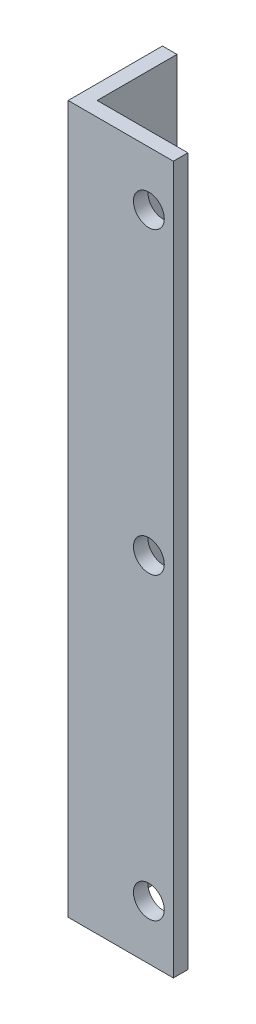
from build123d import *

# Parameters (mm, degrees)
CROQUIS1_W              = 25
CROQUIS1_H              = 3
SALIENTE_EXTRUIR1_DEPTH = 195
CROQUIS2_R              = 4.25
CORTAR_EXTRUIR1_DEPTH   = 195
CROQUIS3_W              = 4
CROQUIS3_H              = 25
SALIENTE_EXTRUIR2_DEPTH = 195
SALIENTE_EXTRUIR3_START = 1
CROQUIS4_W              = 29
CROQUIS4_H              = 195
CROQUIS4_R              = 4.25
SALIENTE_EXTRUIR3_DEPTH = 1


with BuildPart() as part:
    # Croquis1 → Saliente-Extruir1 (new body)
    with BuildSketch(Plane(origin=(0, 0, 0), x_dir=(1, 0, 0), z_dir=(0, 1, 0))):
        with Locations((12.5, -1.5)):
            Rectangle(CROQUIS1_W, CROQUIS1_H)
    extrude(amount=SALIENTE_EXTRUIR1_DEPTH)

    # Croquis2 → Cortar-Extruir1 (cut)
    with BuildSketch(Plane.XY.offset(3)):
        with Locations((18.25, 180)):
            Circle(CROQUIS2_R)
        with Locations((18.25, 97.5)):
            Circle(CROQUIS2_R)
        with Locations((18.25, 15)):
            Circle(CROQUIS2_R)
    extrude(amount=-CORTAR_EXTRUIR1_DEPTH, mode=Mode.SUBTRACT)

    # Croquis3 → Saliente-Extruir2 (add)
    with BuildSketch(Plane(origin=(0, 195, 0), x_dir=(1, 0, 0), z_dir=(0, 1, 0))):
        with Locations((-2, 9.5)):
            Rectangle(CROQUIS3_W, CROQUIS3_H)
    extrude(amount=-SALIENTE_EXTRUIR2_DEPTH)

    # Croquis4 → Saliente-Extruir3 (add)
    with BuildSketch(Plane.XY.offset(3).offset(SALIENTE_EXTRUIR3_START)):
        with Locations((10.5, 97.5)):
            Rectangle(CROQUIS4_W, CROQUIS4_H)
        with Locations((18.25, 15)):
            Circle(CROQUIS4_R, mode=Mode.SUBTRACT)
        with Locations((18.25, 97.5)):
            Circle(CROQUIS4_R, mode=Mode.SUBTRACT)
        with Locations((18.25, 180)):
            Circle(CROQUIS4_R, mode=Mode.SUBTRACT)
    extrude(amount=-SALIENTE_EXTRUIR3_DEPTH)


solid = part.part
